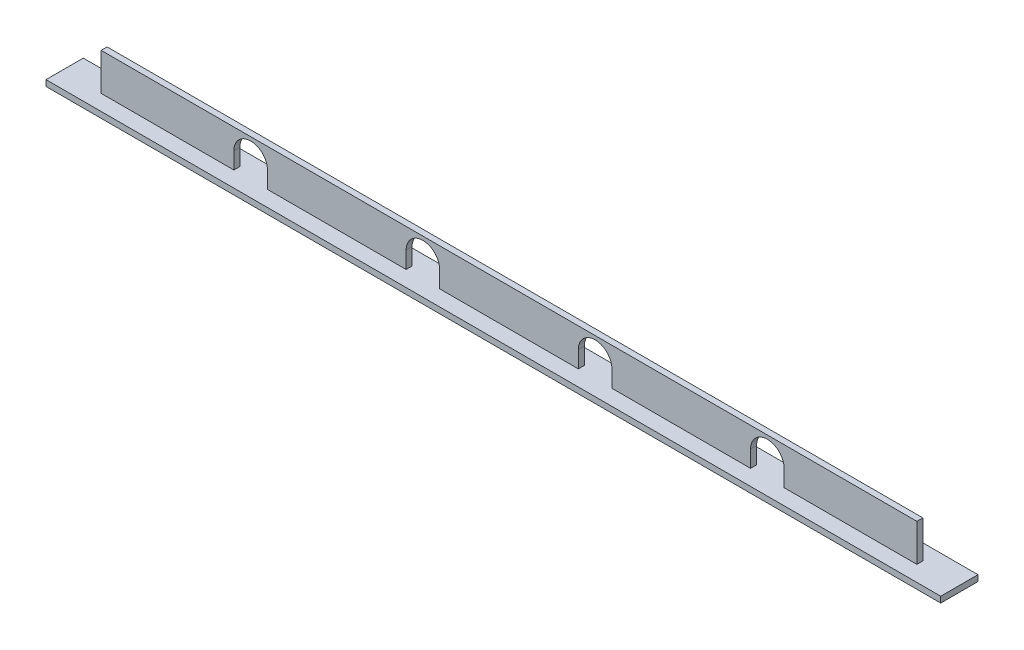
from build123d import *

# Parameters (mm, degrees)
EXTRUDE_1_DEPTH      = 4
SKETCH_3_OUTSIDE_W   = 1454.212
SKETCH_3_OUTSIDE_H   = 252.212
SKETCH_3_OUTSIDE_W_2 = 1094
SKETCH_3_OUTSIDE_H_2 = 8
CUT_EXTRUDE_1_DEPTH  = 608.075777807
SKETCH_2_W           = 1200
SKETCH_2_H           = 50
EXTRUDE_2_DEPTH      = 8


with BuildPart() as part:
    # Эскиз1 → Бобышка-Вытянуть1 (new, symmetric)
    with BuildSketch(Plane.XY):
        with BuildLine():
            Line((-600, -2.5), (-600, -25))
            Line((-600, -25), (-605, -25))
            Line((-605, -25), (-605, 25))
            Line((-605, 25), (605, 25))
            Line((605, 25), (605, -25))
            Line((605, -25), (600, -25))
            Line((600, -25), (600, -2.5))
            ThreePointArc((600, -2.5), (577.5, 20), (555, -2.5))
            Line((555, -2.5), (555, -25))
            Line((555, -25), (369, -25))
            Line((369, -25), (369, -2.5))
            ThreePointArc((369, -2.5), (346.5, 20), (324, -2.5))
            Line((324, -2.5), (324, -25))
            Line((324, -25), (138, -25))
            Line((138, -25), (138, -2.5))
            ThreePointArc((138, -2.5), (115.5, 20), (93, -2.5))
            Line((93, -2.5), (93, -25))
            Line((93, -25), (-93, -25))
            Line((-93, -25), (-93, -2.5))
            ThreePointArc((-93, -2.5), (-115.5, 20), (-138, -2.5))
            Line((-138, -2.5), (-138, -25))
            Line((-138, -25), (-324, -25))
            Line((-324, -25), (-324, -2.5))
            ThreePointArc((-324, -2.5), (-346.5, 20), (-369, -2.5))
            Line((-369, -2.5), (-369, -25))
            Line((-369, -25), (-555, -25))
            Line((-555, -25), (-555, -2.5))
            ThreePointArc((-555, -2.5), (-577.5, 20), (-600, -2.5))
        make_face()
    extrude(amount=EXTRUDE_1_DEPTH, both=True)

    # Эскиз3 outside → Вырез-Вытянуть1 (cut, through all)
    with BuildSketch(Plane(origin=(0, 25, 0), x_dir=(1, 0, 0), z_dir=(0, 1, 0))):
        Rectangle(SKETCH_3_OUTSIDE_W, SKETCH_3_OUTSIDE_H)
        Rectangle(SKETCH_3_OUTSIDE_W_2, SKETCH_3_OUTSIDE_H_2, mode=Mode.SUBTRACT)
    extrude(amount=-CUT_EXTRUDE_1_DEPTH, mode=Mode.SUBTRACT)


with BuildPart() as body_2:
    # Эскиз2 → Бобышка-Вытянуть2 (new body)
    with BuildSketch(Plane.XZ.offset(25)):
        Rectangle(SKETCH_2_W, SKETCH_2_H)
    extrude(amount=EXTRUDE_2_DEPTH)


solid = Compound([part.part, body_2.part])
